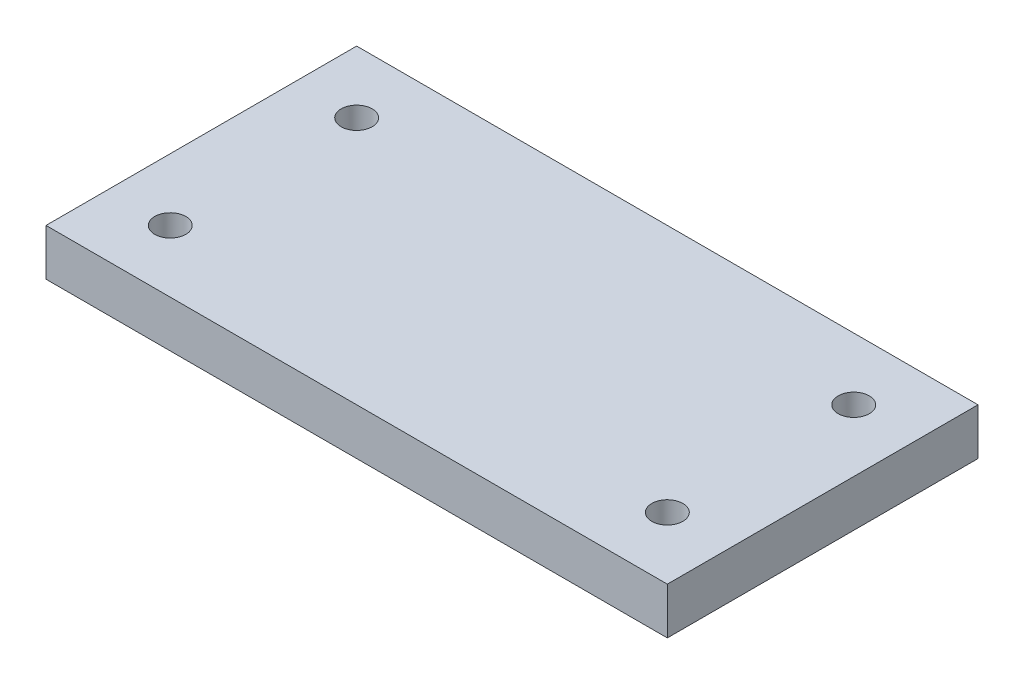
from build123d import *

# Parameters (mm, degrees)
SKETCH_1_W          = 200
SKETCH_1_H          = 100
EXTRUDE_1_DEPTH     = 15
SKETCH_2_R          = 5
CUT_EXTRUDE_1_DEPTH = 30
SKETCH_3_R          = 5
CUT_EXTRUDE_2_DEPTH = 30


with BuildPart() as part:
    # 草图1 → 凸台-拉伸1 (new body)
    with BuildSketch(Plane(origin=(0, 0, 0), x_dir=(1, 0, 0), z_dir=(0, 1, 0))):
        Rectangle(SKETCH_1_W, SKETCH_1_H)
    extrude(amount=EXTRUDE_1_DEPTH)

    # 草图2 → 切除-拉伸1 (cut)
    with BuildSketch(Plane(origin=(0, 0, 0), x_dir=(1, 0, 0), z_dir=(0, 1, 0))):
        with Locations(Location((-80, -30, 0), (0, 0, 90))):
            Circle(SKETCH_2_R)
        with Locations(Location((80, -30, 0), (0, 0, 90))):
            Circle(SKETCH_2_R)
        with Locations(Location((-80, 30, 0), (0, 0, 90))):
            Circle(SKETCH_2_R)
    extrude(amount=CUT_EXTRUDE_1_DEPTH, mode=Mode.SUBTRACT)

    # 草图3 → 切除-拉伸2 (cut)
    with BuildSketch(Plane(origin=(0, 0, 0), x_dir=(1, 0, 0), z_dir=(0, 1, 0))):
        with Locations(Location((80, 30, 0), (0, 0, 90))):
            Circle(SKETCH_3_R)
    extrude(amount=CUT_EXTRUDE_2_DEPTH, mode=Mode.SUBTRACT)


solid = part.part
